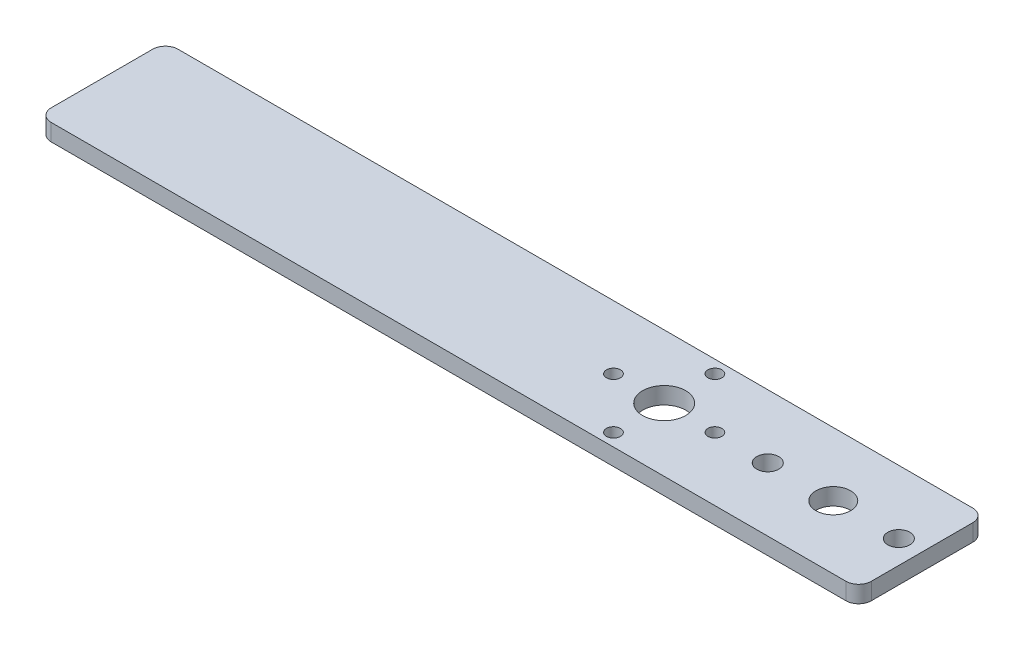
from build123d import *

# Parameters (mm, degrees)
SKETCH_2_R      = 5.1
SKETCH_2_R_2    = 4.1
SKETCH_2_R_3    = 1.65
SKETCH_2_R_4    = 2.6
EXTRUDE_2_DEPTH = 4


with BuildPart() as part:
    # 草图2 → 凸台-拉伸2 (new body)
    with BuildSketch(Plane(origin=(0, 0, 0), x_dir=(1, 0, 0), z_dir=(0, 1, 0))):
        with BuildLine():
            Line((-42, 15), (146, 15))
            ThreePointArc((146, 15), (148.121320344, 14.121320344), (149, 12))
            Line((149, 12), (149, -12))
            ThreePointArc((149, -12), (148.121320344, -14.121320344), (146, -15))
            Line((146, -15), (-42, -15))
            ThreePointArc((-42, -15), (-44.121320344, -14.121320344), (-45, -12))
            Line((-45, -12), (-45, 12))
            ThreePointArc((-45, 12), (-44.121320344, 14.121320344), (-42, 15))
        make_face()
        with Locations(Location((88, 0, 0), (0, 0, 270))):
            Circle(SKETCH_2_R, mode=Mode.SUBTRACT)
        with Locations(Location((128, 0, 0), (0, 0, 270))):
            Circle(SKETCH_2_R_2, mode=Mode.SUBTRACT)
        with Locations(Location((88, 12, 0), (0, 0, 270))):
            Circle(SKETCH_2_R_3, mode=Mode.SUBTRACT)
        with Locations(Location((88, -12, 0), (0, 0, 270))):
            Circle(SKETCH_2_R_3, mode=Mode.SUBTRACT)
        with Locations(Location((76, 0, 0), (0, 0, 270))):
            Circle(SKETCH_2_R_3, mode=Mode.SUBTRACT)
        with Locations(Location((100, 0, 0), (0, 0, 90))):
            Circle(SKETCH_2_R_3, mode=Mode.SUBTRACT)
        with Locations(Location((143.5, 0, 0), (0, 0, 270))):
            Circle(SKETCH_2_R_4, mode=Mode.SUBTRACT)
        with Locations(Location((112.5, 0, 0), (0, 0, 270))):
            Circle(SKETCH_2_R_4, mode=Mode.SUBTRACT)
    extrude(amount=EXTRUDE_2_DEPTH)


solid = part.part
